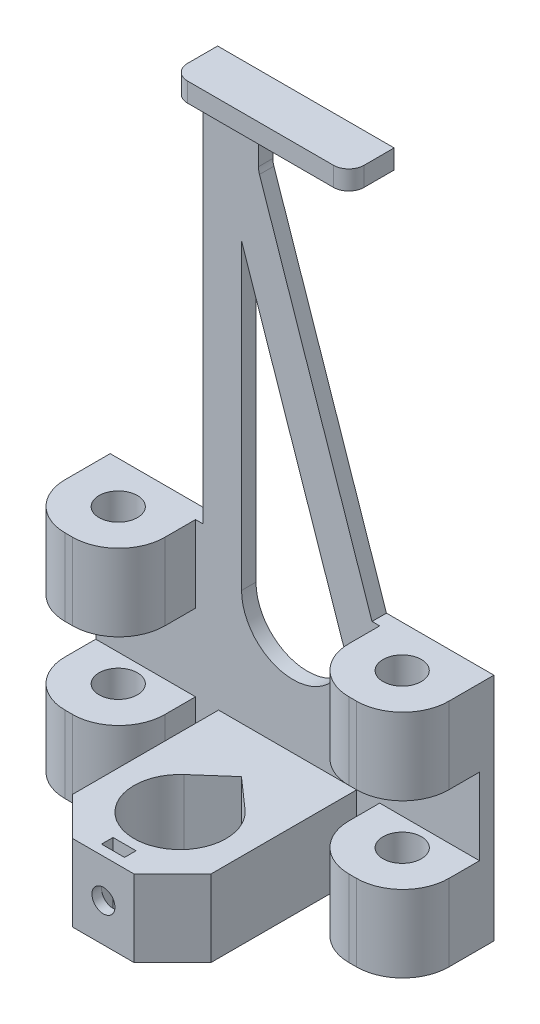
from build123d import *

# Parameters (mm, degrees)
SALIENTE_EXTRUIR1_DEPTH = 1.88
SALIENTE_EXTRUIR2_DEPTH = 4.03
REDONDEO1_R             = 2
CROQUIS3_W              = 13
CROQUIS3_H              = 10
SALIENTE_EXTRUIR3_DEPTH = 10
REDONDEO2_R             = 6
CROQUIS4_W              = 18
CROQUIS4_H              = 10
SALIENTE_EXTRUIR4_DEPTH = 24
CHAFL_N1_SIZE           = 5
CORTAR_EXTRUIR1_DEPTH   = 24
CROQUIS6_R              = 1.5
CORTAR_EXTRUIR2_DEPTH   = 14
CROQUIS7_W              = 3
CROQUIS7_H              = 1.5
CORTAR_EXTRUIR3_DEPTH   = 14
CROQUIS8_R              = 2.5
CORTAR_EXTRUIR4_DEPTH   = 65.060708707


with BuildPart() as part:
    # Croquis1 → Saliente-Extruir1 (new body)
    with BuildSketch(Plane.XY):
        with BuildLine():
            Line((-11, 15), (-11, 68))
            Line((-11, 68), (12, 68))
            Line((12, 68), (12, 65.5))
            Line((12, 65.5), (-1.3, 65.5))
            ThreePointArc((-1.3, 65.5), (-3.067766953, 64.767766953), (-3.8, 63))
            Line((-3.8, 63), (-3.8, 58.913644565))
            ThreePointArc((-3.8, 58.913644565), (-3.7664666, 58.505548363), (-3.666765992, 58.108400044))
            Line((-3.666765992, 58.108400044), (11, 15))
            Line((11, 15), (25, 15))
            Line((25, 15), (25, -15))
            Line((25, -15), (-25, -15))
            Line((-25, -15), (-25, 15))
            Line((-25, 15), (-11, 15))
        make_face()
        with BuildLine():
            Line((-6, 10), (-6, 49.44298114))
            Line((-6, 49.44298114), (7.419680939, 10))
            ThreePointArc((7.419680939, 10), (0.70984047, 3.29015953), (-6, 10))
        make_face(mode=Mode.SUBTRACT)
    extrude(amount=SALIENTE_EXTRUIR1_DEPTH)

    # Croquis2 → Saliente-Extruir2 (add)
    with BuildSketch(Plane.XY.offset(1.88)):
        Polygon((-1.3, 65.5), (-11, 65.5), (-11, 68), (12, 68), (12, 65.5), align=None)
    extrude(amount=SALIENTE_EXTRUIR2_DEPTH)

    # Redondeo1
    redondeo1_edges = [part.edges().sort_by_distance(p)[0] for p in [
        (-11, 66.75, 5.91),
        (12, 66.75, 5.91),
    ]]
    fillet(redondeo1_edges, radius=REDONDEO1_R)

    # Croquis3 → Saliente-Extruir3 (add)
    with BuildSketch(Plane.XY.offset(1.88)):
        with Locations((-18.5, 10)):
            Rectangle(CROQUIS3_W, CROQUIS3_H)
        with Locations((-18.5, -10)):
            Rectangle(CROQUIS3_W, CROQUIS3_H)
        with Locations((18.5, -10)):
            Rectangle(CROQUIS3_W, CROQUIS3_H)
        with Locations((18.5, 10)):
            Rectangle(CROQUIS3_W, CROQUIS3_H)
    extrude(amount=SALIENTE_EXTRUIR3_DEPTH)

    # Redondeo2
    redondeo2_edges = [part.edges().sort_by_distance(p)[0] for p in [
        (25, -10, 11.88),
        (12, -10, 11.88),
        (25, 10, 11.88),
        (12, 10, 11.88),
        (-25, 10, 11.88),
        (-12, 10, 11.88),
        (-25, -10, 11.88),
        (-12, -10, 11.88),
    ]]
    fillet(redondeo2_edges, radius=REDONDEO2_R)

    # Croquis4 → Saliente-Extruir4 (add)
    with BuildSketch(Plane.XY.offset(1.88)):
        with Locations((0, -10)):
            Rectangle(CROQUIS4_W, CROQUIS4_H)
    extrude(amount=SALIENTE_EXTRUIR4_DEPTH)

    # Chaflán1
    chafl_n1_edges = [part.edges().sort_by_distance(p)[0] for p in [
        (9, -10, 25.88),
        (-9, -10, 25.88),
    ]]
    chamfer(chafl_n1_edges, length=CHAFL_N1_SIZE)

    # Croquis5 → Cortar-Extruir1 (cut)
    with BuildSketch(Plane(origin=(0, -5, 0), x_dir=(1, 0, 0), z_dir=(0, 1, 0))):
        with BuildLine():
            Line((0, -7.895), (-3.968626967, -11.395))
            ThreePointArc((-3.968626967, -11.395), (0, -21.895), (3.968626967, -11.395))
            Line((3.968626967, -11.395), (0, -7.895))
        make_face()
    extrude(amount=-CORTAR_EXTRUIR1_DEPTH, mode=Mode.SUBTRACT)

    # Croquis6 → Cortar-Extruir2 (cut)
    with BuildSketch(Plane.XY.offset(25.88)):
        with Locations((0, -10)):
            Circle(CROQUIS6_R)
    extrude(amount=-CORTAR_EXTRUIR2_DEPTH, mode=Mode.SUBTRACT)

    # Croquis7 → Cortar-Extruir3 (cut)
    with BuildSketch(Plane(origin=(0, -5, 0), x_dir=(1, 0, 0), z_dir=(0, 1, 0))):
        with Locations((0, -23.88)):
            Rectangle(CROQUIS7_W, CROQUIS7_H)
    extrude(amount=-CORTAR_EXTRUIR3_DEPTH, mode=Mode.SUBTRACT)

    # Croquis8 → Cortar-Extruir4 (cut, through all)
    with BuildSketch(Plane(origin=(0, 15, 0), x_dir=(1, 0, 0), z_dir=(0, 1, 0))):
        with Locations(Location((-18.5, -5.45, 0), (0, 0, 180))):
            Circle(CROQUIS8_R)
        with Locations(Location((18.5, -5.45, 0), (0, 0, 180))):
            Circle(CROQUIS8_R)
    extrude(amount=-CORTAR_EXTRUIR4_DEPTH, mode=Mode.SUBTRACT)


solid = part.part
